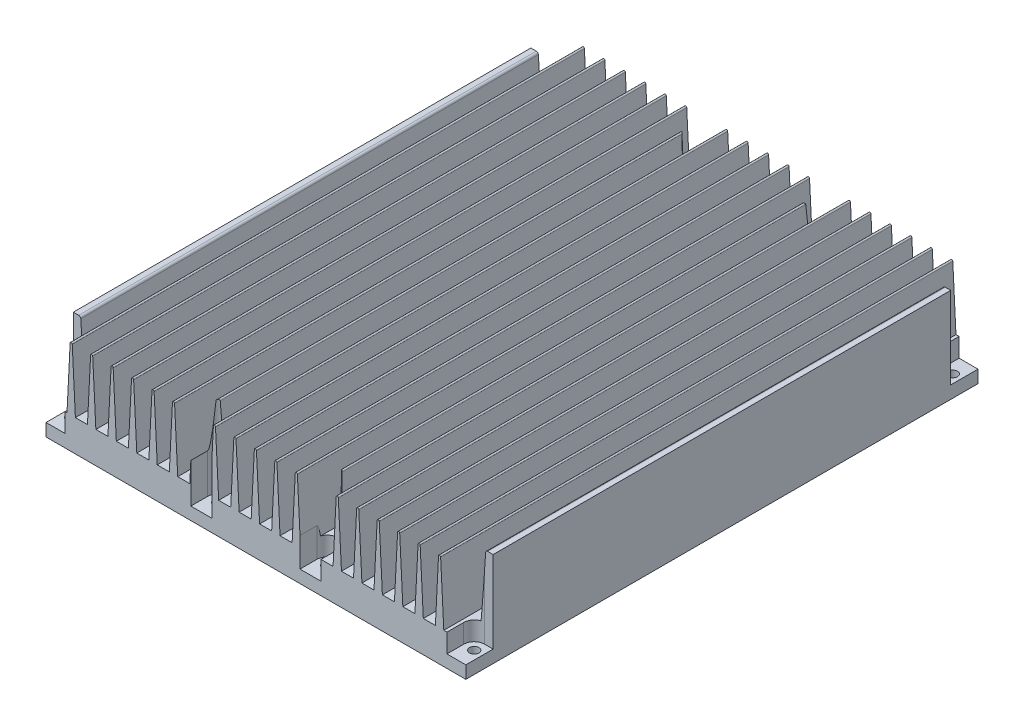
from build123d import *

# Parameters (mm, degrees)
EXTRUDE_1_DEPTH       = 244
EXTRUDE_3_DEPTH       = 244
PATTERN_CURVE_1_COUNT = 19
PATTERN_CURVE_1_PITCH = 9.75
SKETCH_3_R            = 2.25
CUT_EXTRUDE_1_DEPTH   = 50
SKETCH_5_R            = 2.1
SKETCH_5_R_2          = 1.6
CUT_EXTRUDE_2_DEPTH   = 10
CUT_EXTRUDE_3_DEPTH   = 80


with BuildPart() as part:
    # Эскиз1 → Вытянуть1 (new body)
    with BuildSketch(Plane.XY):
        with BuildLine():
            Line((0, 45), (2.564446908, 45))
            ThreePointArc((2.564446908, 45), (3.247630994, 44.730246195), (3.562232066, 44.066519011))
            Line((3.562232066, 44.066519011), (5.5, 15))
            Line((5.5, 15), (194.5, 15))
            Line((194.5, 15), (196.437767934, 44.066519011))
            ThreePointArc((196.437767934, 44.066519011), (196.752369006, 44.730246195), (197.435553092, 45))
            Line((197.435553092, 45), (200, 45))
            Line((200, 45), (200, 0))
            Line((200, 0), (0, 0))
            Line((0, 0), (0, 45))
        make_face()
    extrude(amount=EXTRUDE_1_DEPTH)

    # Эскиз2 → Вытянуть3 (add)
    with BuildSketch(Plane.XY.offset(244)):
        with BuildLine():
            Line((11.5, 44.5), (10, 15))
            Line((10, 15), (14, 15))
            Line((14, 15), (12.5, 44.5))
            ThreePointArc((12.5, 44.5), (12, 45), (11.5, 44.5))
        make_face()
    extrude_3 = extrude(amount=-EXTRUDE_3_DEPTH)

    # Кривая1: Вытянуть3 ×19
    with Locations(*[(i * PATTERN_CURVE_1_PITCH, 0, 0) for i in range(1, PATTERN_CURVE_1_COUNT)]):
        add(extrude_3)

    # Эскиз3 → Вырез-Вытянуть1 (cut)
    with BuildSketch(Plane.XZ):
        with Locations((4, 236)):
            Circle(SKETCH_3_R)
        with Locations((74, 236)):
            Circle(SKETCH_3_R)
        with Locations(Location((74, 8, 0), (0, 0, 131.810314896))):
            Circle(SKETCH_3_R)
        with Locations(Location((4, 8, 0), (0, 0, 311.810314896))):
            Circle(SKETCH_3_R)
        with Locations((196, 8)):
            Circle(SKETCH_3_R)
        with Locations((126, 8)):
            Circle(SKETCH_3_R)
        with Locations(Location((126, 236, 0), (0, 0, 63.612200039))):
            Circle(SKETCH_3_R)
        with Locations(Location((196, 236, 0), (0, 0, 309.644601439))):
            Circle(SKETCH_3_R)
    extrude(amount=-CUT_EXTRUDE_1_DEPTH, mode=Mode.SUBTRACT)

    # Эскиз5 → Вырез-Вытянуть2 (cut)
    with BuildSketch(Plane(origin=(1.487985642, 0, 27.400529356), x_dir=(1, 0, 0), z_dir=(0, -1, 0))):
        with Locations((43.512014358, 22.599470644)):
            Circle(SKETCH_5_R)
        with Locations((81.512014358, 109.099470644)):
            Circle(SKETCH_5_R_2)
        with Locations((38.512014358, 196.599470644)):
            Circle(SKETCH_5_R_2)
        with Locations((38.512014358, 61.599470644)):
            Circle(SKETCH_5_R_2)
        with Locations(Location((158.512014358, 61.599470644, 0), (0, 0, 180))):
            Circle(SKETCH_5_R_2)
        with Locations(Location((115.512014358, 109.099470644, 0), (0, 0, 180))):
            Circle(SKETCH_5_R_2)
        with Locations(Location((158.512014358, 196.599470644, 0), (0, 0, 180))):
            Circle(SKETCH_5_R_2)
    extrude(amount=-CUT_EXTRUDE_2_DEPTH, mode=Mode.SUBTRACT)

    # Эскиз6 → Вырез-Вытянуть3 (cut)
    with BuildSketch(Plane.XZ.offset(-6)):
        with BuildLine():
            Line((9, 236), (9, 247.625328498))
            Line((9, 247.625328498), (-6.127764857, 247.625328498))
            Line((-6.127764857, 247.625328498), (-6.127764857, 231))
            Line((-6.127764857, 231), (4, 231))
            ThreePointArc((4, 231), (7.535533906, 232.464466094), (9, 236))
        make_face()
        with BuildLine():
            Line((69, 236), (69, 248.983105869))
            Line((69, 248.983105869), (79, 248.983105869))
            Line((79, 248.983105869), (79, 236))
            ThreePointArc((79, 236), (74, 231), (69, 236))
        make_face()
        with BuildLine():
            Line((121, 248.983105869), (121, 236))
            ThreePointArc((121, 236), (126, 231), (131, 236))
            Line((131, 236), (131, 248.983105869))
            Line((131, 248.983105869), (121, 248.983105869))
        make_face()
        with BuildLine():
            Line((206.127764857, 247.625328498), (191, 247.625328498))
            Line((191, 247.625328498), (191, 236))
            ThreePointArc((191, 236), (192.464466094, 232.464466094), (196, 231))
            Line((196, 231), (206.127764857, 231))
            Line((206.127764857, 231), (206.127764857, 247.625328498))
        make_face()
        with BuildLine():
            Line((191, 8), (191, -3.625328498))
            Line((191, -3.625328498), (206.127764857, -3.625328498))
            Line((206.127764857, -3.625328498), (206.127764857, 13))
            Line((206.127764857, 13), (196, 13))
            ThreePointArc((196, 13), (192.464466094, 11.535533906), (191, 8))
        make_face()
        with BuildLine():
            Line((131, 8), (131, -4.983105869))
            Line((131, -4.983105869), (121, -4.983105869))
            Line((121, -4.983105869), (121, 8))
            ThreePointArc((121, 8), (126, 13), (131, 8))
        make_face()
        with BuildLine():
            Line((79, -4.983105869), (79, 8))
            ThreePointArc((79, 8), (74, 13), (69, 8))
            Line((69, 8), (69, -4.983105869))
            Line((69, -4.983105869), (79, -4.983105869))
        make_face()
        with BuildLine():
            Line((-6.127764857, -3.625328498), (9, -3.625328498))
            Line((9, -3.625328498), (9, 8))
            ThreePointArc((9, 8), (7.535533906, 11.535533906), (4, 13))
            Line((4, 13), (-6.127764857, 13))
            Line((-6.127764857, 13), (-6.127764857, -3.625328498))
        make_face()
    extrude(amount=-CUT_EXTRUDE_3_DEPTH, mode=Mode.SUBTRACT)


solid = part.part
